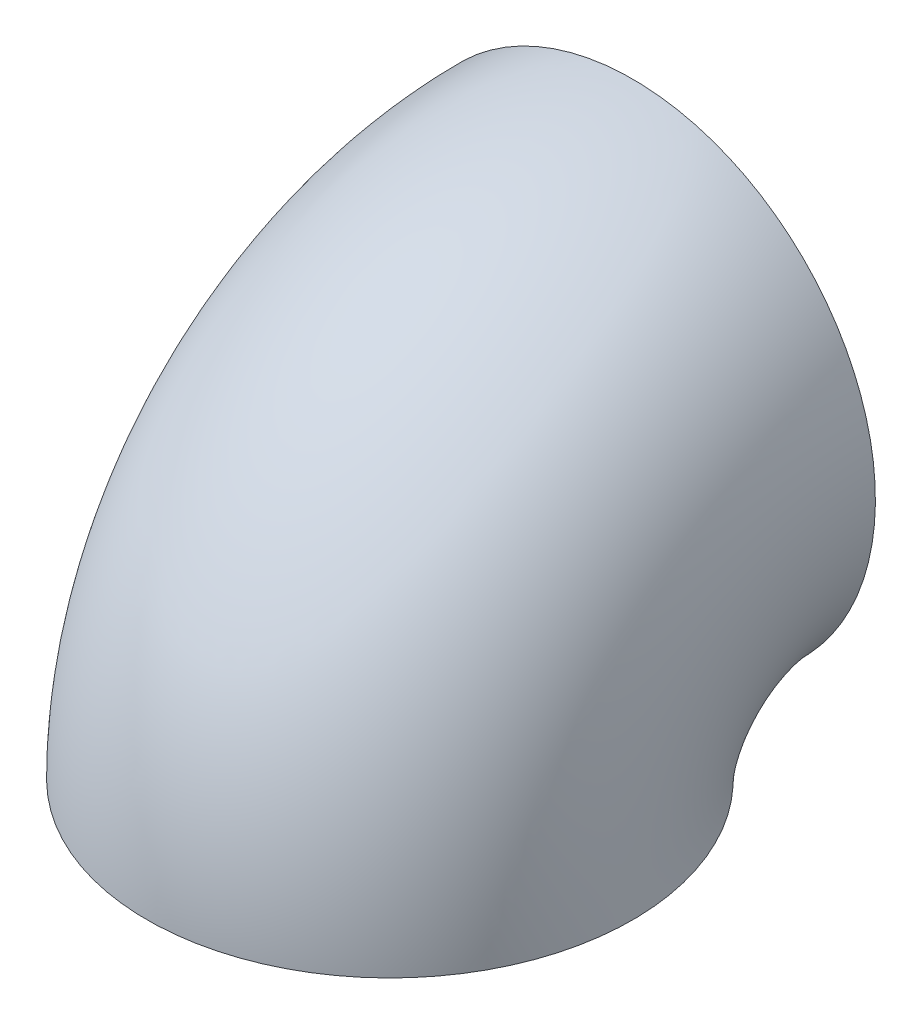
from build123d import *

# Parameters (mm, degrees)
SKETCH2_R   = 45
SKETCH2_R_2 = 10


with BuildPart() as part:
    # Sweep1: sweep along a path in Sketch1
    with BuildLine(Plane(origin=(0, 0, 0), x_dir=(0, 0, -1), z_dir=(1, 0, 0))) as sweep1_path:
        ThreePointArc((0, 45), (-31.819805153, 31.819805153), (-45, 0))
    # Sketch2 → Sweep1 (sweep)
    with BuildSketch(Plane(origin=(0, 0, 0), x_dir=(1, 0, 0), z_dir=(0, 1, 0))):
        with Locations((0, -45)):
            Circle(SKETCH2_R)
        with Locations((0, -45)):
            Circle(SKETCH2_R_2, mode=Mode.SUBTRACT)
    sweep(path=sweep1_path.line)


solid = part.part
